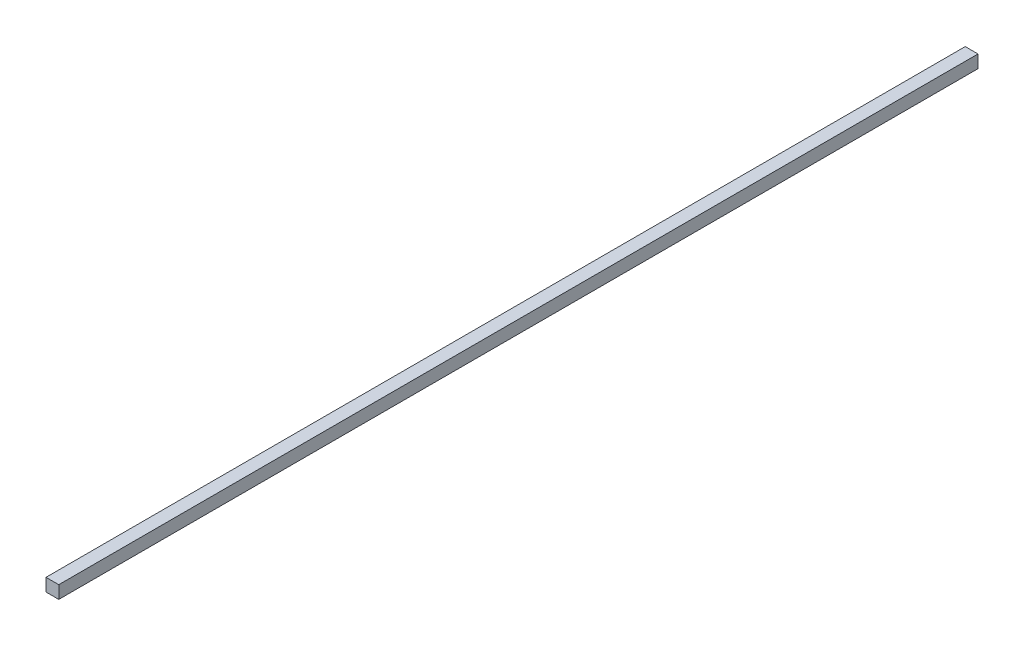
from build123d import *

# Parameters (mm, degrees)
SKETCH1_W           = 25.4
SKETCH1_H           = 25.4
BOSS_EXTRUDE1_DEPTH = 1828.8


with BuildPart() as part:
    # Sketch1 → Boss-Extrude1 (new body)
    with BuildSketch(Plane.XY):
        with Locations((12.7, 12.7)):
            Rectangle(SKETCH1_W, SKETCH1_H)
    extrude(amount=BOSS_EXTRUDE1_DEPTH)


solid = part.part
